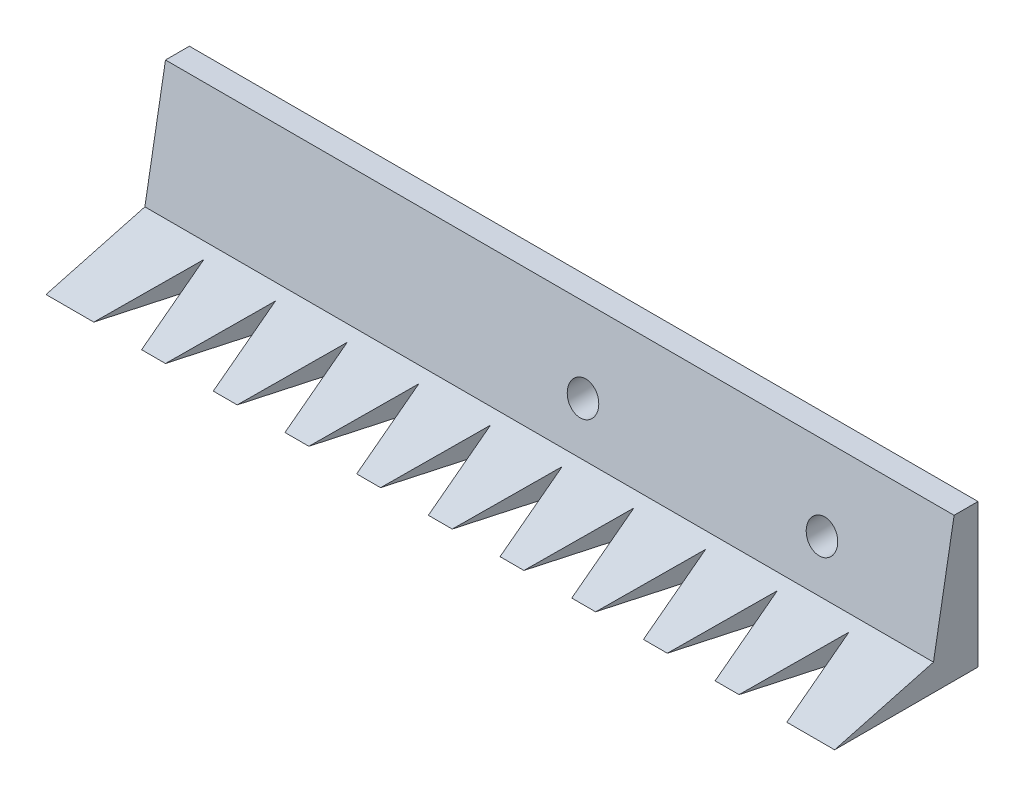
from build123d import *

# Parameters (mm, degrees)
BOSS_EXTRUDE1_DEPTH  = 100
M3_CLEARANCE_HOLE1_D = 3.4
SKETCH4_R            = 3.25
CUT_EXTRUDE1_DEPTH   = 108.964114408
BOSS_EXTRUDE2_DEPTH  = 65
CUT_EXTRUDE2_DEPTH   = 109.627804912
LPATTERN1_COUNT      = 10
LPATTERN1_PITCH      = 15


with BuildPart() as part:
    # Sketch1 → Boss-Extrude1 (new body)
    with BuildSketch(Plane(origin=(0, 0, 0), x_dir=(0, 0, -1), z_dir=(1, 0, 0))):
        Polygon((0, 0), (0, 30), (-5, 30), (-9.312388631, 5.54322876), (-30, 0), align=None)
    extrude(amount=BOSS_EXTRUDE1_DEPTH)

    # M3 Clearance Hole1 (through all)
    with Locations(Plane(origin=(0, 0, 0), x_dir=(-1, 0, 0), z_dir=(0, 0, -1))):
        with Locations((-25, 15), (-75, 15)):
            Hole(M3_CLEARANCE_HOLE1_D / 2)

    # Sketch4 → Cut-Extrude1 (cut, through all)
    with BuildSketch(Plane(origin=(0, 0, 2.5), x_dir=(-1, 0, 0), z_dir=(0, 0, -1))):
        with Locations((-75, 15)):
            Circle(SKETCH4_R)
        with Locations((-25, 15)):
            Circle(SKETCH4_R)
    extrude(amount=-CUT_EXTRUDE1_DEPTH, mode=Mode.SUBTRACT)

    # Sketch6 → Boss-Extrude2 (add)
    with BuildSketch(Plane.ZY):
        Polygon((0, 0), (30, 0), (9.312388631, 5.54322876), (5, 30), (0, 30), align=None)
    extrude(amount=BOSS_EXTRUDE2_DEPTH)

    # Sketch7 → Cut-Extrude2 (cut, symmetric)
    with BuildSketch(Plane(origin=(0, 0, 0), x_dir=(1, 0, 0), z_dir=(0, 1, 0))):
        Polygon((-55, -30), (-50, -12), (-45, -30), align=None)
    cut_extrude2 = extrude(amount=CUT_EXTRUDE2_DEPTH, both=True, mode=Mode.SUBTRACT)

    # LPattern1: Cut-Extrude2 ×10
    with Locations(*[(i * LPATTERN1_PITCH, 0, 0) for i in range(1, LPATTERN1_COUNT)]):
        add(cut_extrude2, mode=Mode.SUBTRACT)


solid = part.part
